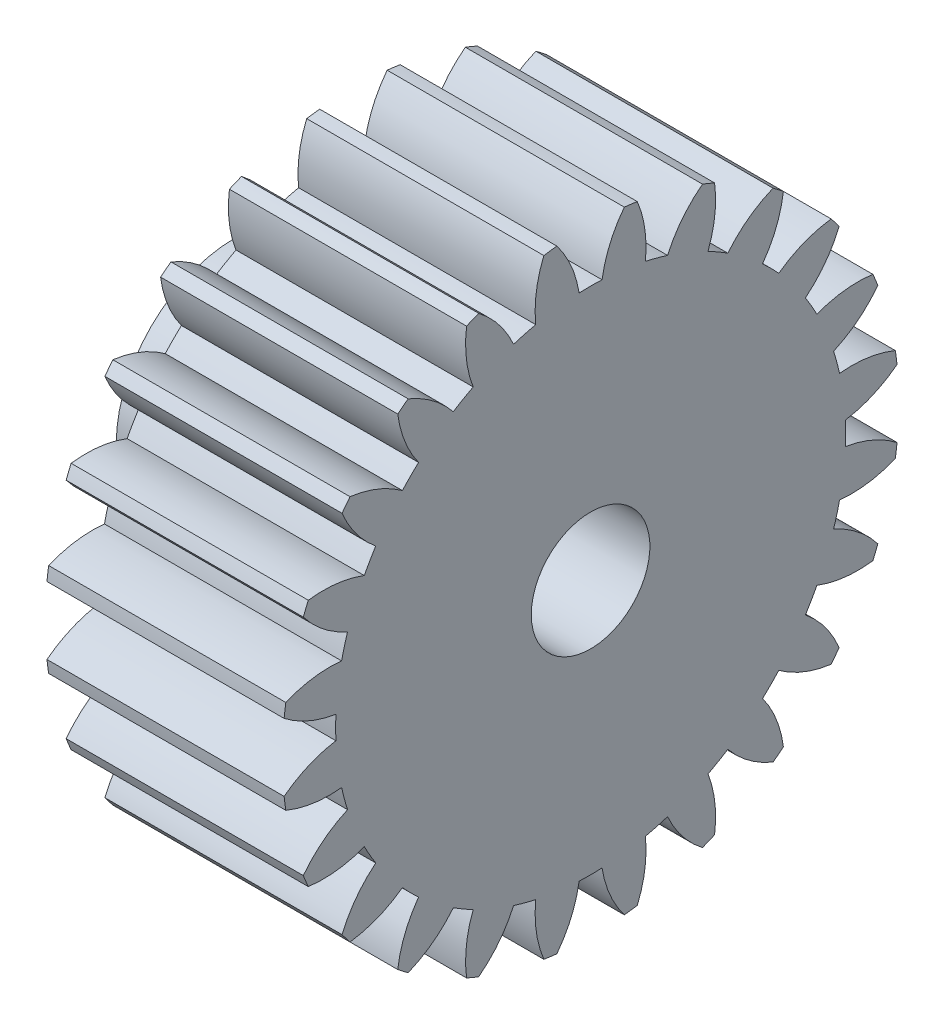
from build123d import *

# Parameters (mm, degrees)
BASPROSKE_W      = 10
BASPROSKE_H      = 13
TOOTHCUT_DEPTH   = 21.928449536
TEETHCUTS_COUNT  = 24
TEETHCUTS_ANGLE  = 345
HUBNEAONESKE_R   = 5
HUBNEARONE_DEPTH = 5.0000508
BORSKE_R         = 2.5
BORE_DEPTH       = 15.0000508


with BuildPart() as part:
    # BasProSke → Base-Revolve (revolve)
    with BuildSketch(Plane(origin=(0, 0, 0), x_dir=(1, 0, 0), z_dir=(0, 1, 0)), mode=Mode.PRIVATE) as base_revolve_sk:
        with Locations((5, 6.5)):
            Rectangle(BASPROSKE_W, BASPROSKE_H)
    revolve(base_revolve_sk.sketch.rotate(Axis((-10, 0, 0), (1, 0, 0)), 180), axis=Axis((-10, 0, 0), (1, 0, 0)))

    # TooCutSke → ToothCut (cut, through all)
    with BuildSketch(Plane(origin=(0, 0, 0), x_dir=(0, 0, -1), z_dir=(1, 0, 0))):
        with BuildLine():
            ThreePointArc((0.483448384, 10.738122679), (0, 10.749), (-0.483448384, 10.738122679))
            ThreePointArc((-0.483448384, 10.738122679), (-0.821636462, 11.902754369), (-1.44092227, 12.945454344))
            ThreePointArc((-1.44092227, 12.945454344), (0, 13.0254), (1.44092227, 12.945454344))
            ThreePointArc((1.44092227, 12.945454344), (0.821636462, 11.902754369), (0.483448384, 10.738122679))
        make_face()
    toothcut = extrude(amount=TOOTHCUT_DEPTH, mode=Mode.SUBTRACT)

    # TeethCuts: ToothCut ×24 about axis
    teethcuts_axis = Axis((-10, 0, 0), (1, 0, 0))
    for i in range(1, TEETHCUTS_COUNT):
        add(toothcut.rotate(teethcuts_axis, i * TEETHCUTS_ANGLE / (TEETHCUTS_COUNT - 1)), mode=Mode.SUBTRACT)

    # HubNeaOneSke → HubNearOne (add)
    with BuildSketch(Plane.ZY):
        with Locations(Location((0, 0, 0), (0, 0, 180))):
            Circle(HUBNEAONESKE_R)
    extrude(amount=HUBNEARONE_DEPTH)

    # BorSke → Bore (cut, symmetric)
    with BuildSketch(Plane(origin=(0, 0, 0), x_dir=(0, 0, -1), z_dir=(1, 0, 0))):
        with Locations(Location((0, 0, 0), (0, 0, 180))):
            Circle(BORSKE_R)
    extrude(amount=BORE_DEPTH, both=True, mode=Mode.SUBTRACT)


solid = part.part
